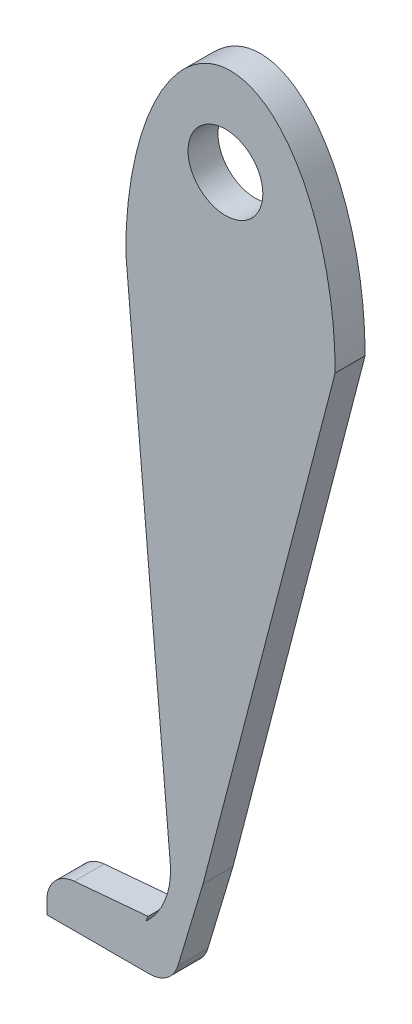
from build123d import *

# Parameters (mm, degrees)
BOSS_EXTRUDE1_DEPTH = 2
FILLET2_R           = 2
FILLET3_R           = 2
CUT_EXTRUDE4_DEPTH  = 2
SKETCH2_R           = 2.5
CUT_EXTRUDE5_DEPTH  = 2


with BuildPart() as part:
    # Sketch1 → Boss-Extrude1 (new body)
    with BuildSketch(Plane.XY):
        with BuildLine():
            Line((-0.5, 0), (8.33647894, 34))
            add(Edge.make_bspline(
                [(8.33647894, 34), (8.33647894, 48), (1.33647894, 48), (-5.66352106, 48), (-5.66352106, 34)],
                knots=[4.71238898, 4.71238898, 4.71238898, 6.283185307, 6.283185307, 7.853981634, 7.853981634, 7.853981634], degree=2, weights=[1, 0.707106781, 1, 0.707106781, 1]))
            Line((-5.66352106, 34), (-2.680262594, 0))
            Line((-2.680262594, 0), (-4.171891827, -3.708387008))
            Line((-4.171891827, -3.708387008), (-10.935278617, -4.301826152))
            Line((-10.935278617, -4.301826152), (-10.935278617, -7))
            Line((-10.935278617, -7), (-2.606289546, -7))
            Line((-2.606289546, -7), (-0.5, 0))
        make_face()
    extrude(amount=BOSS_EXTRUDE1_DEPTH)

    # Fillet2
    fillet2_edges = [part.edges().sort_by_distance(p)[0] for p in [
        (-10.935278617, -4.301826152, 1),
    ]]
    fillet(fillet2_edges, radius=FILLET2_R)

    # Fillet3
    fillet3_edges = [part.edges().sort_by_distance(p)[0] for p in [
        (-2.606289546, -7, 1),
    ]]
    fillet(fillet3_edges, radius=FILLET3_R)

    # Sketch4 → Cut-Extrude4 (cut)
    with BuildSketch(Plane.XY.offset(2)):
        with BuildLine():
            Line((-2.680262594, 0), (-4.311151099, -4.054603926))
            ThreePointArc((-4.311151099, -4.054603926), (-3.040183524, -2.21052769), (-2.680262594, 0))
        make_face()
    extrude(amount=-CUT_EXTRUDE4_DEPTH, mode=Mode.SUBTRACT)

    # Sketch2 → Cut-Extrude5 (cut)
    with BuildSketch(Plane.XY.offset(2)):
        with Locations((1, 41.95)):
            Circle(SKETCH2_R)
    extrude(amount=-CUT_EXTRUDE5_DEPTH, mode=Mode.SUBTRACT)


solid = part.part
